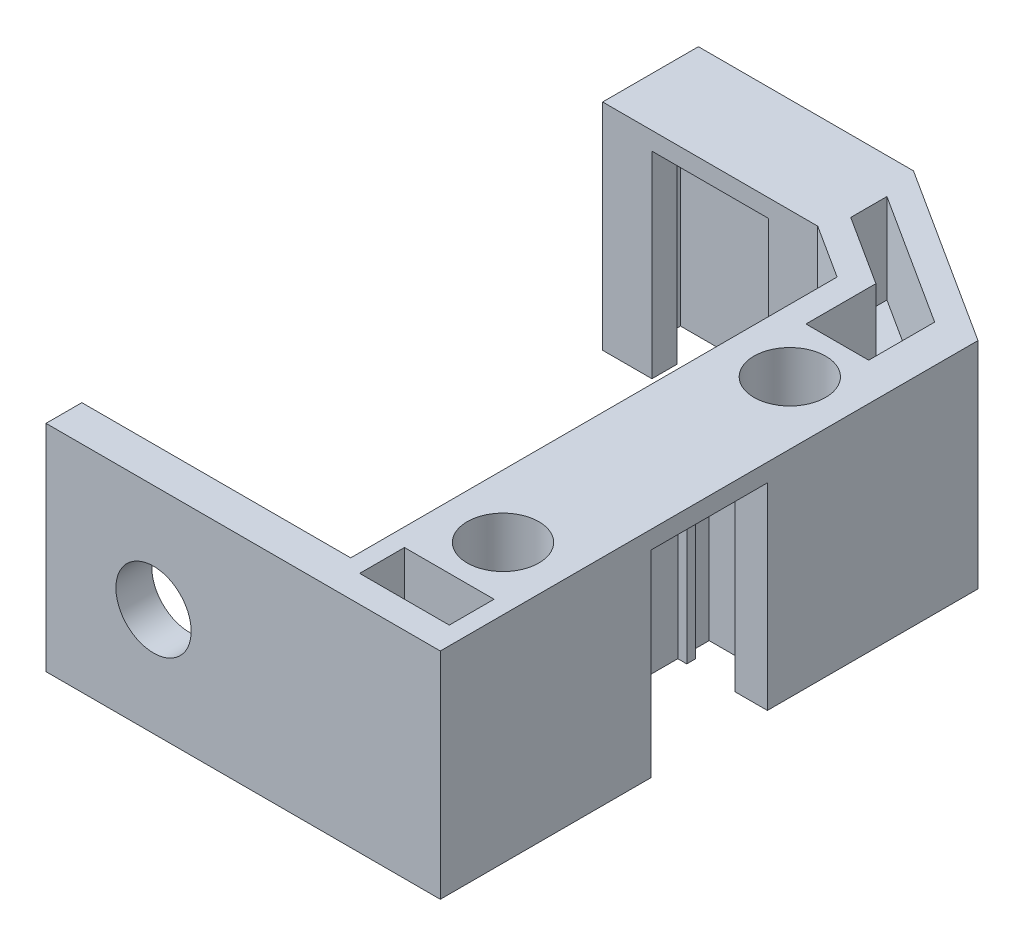
from build123d import *

# Parameters (mm, degrees)
EXTRUDE_1_DEPTH     = 12
SKETCH_2_W          = 5
SKETCH_2_H          = 2.5
CUT_EXTRUDE_1_DEPTH = 5
CUT_EXTRUDE_START   = -12
SKETCH_2_3_W        = 5
SKETCH_2_3_H        = 2.5
CUT_EXTRUDE_3_DEPTH = 5
SKETCH_2_4_R        = 2
CUT_EXTRUDE_4_DEPTH = 45.192307023
CUT_EXTRUDE_5_DEPTH = 11
SKETCH1_R           = 2.1
CUT_EXTRUDE1_DEPTH  = 43.560075188


with BuildPart() as part:
    # 草图1 → 凸台-拉伸1 (new body)
    with BuildSketch(Plane(origin=(0, 0, 0), x_dir=(1, 0, 0), z_dir=(0, 1, 0))):
        Polygon((0, 0), (0, 2), (15, 2), (15, 29.137304051), (12, 31.057304051), (0, 31.057304051), (0, 36.4), (12, 36.4), (22, 30), (22, 0), align=None)
    extrude(amount=EXTRUDE_1_DEPTH)

    # 草图2 → 切除-拉伸1 (cut)
    with BuildSketch(Plane.XZ):
        Polygon((12.5, -32.399476124), (12.5, -34.417827927), (19.9, -29.681827927), (19.9, -26), (16.4, -26), (16.4, -29.903476124), align=None)
        with Locations((18.5, -2.75)):
            Rectangle(SKETCH_2_W, SKETCH_2_H)
    extrude(amount=-CUT_EXTRUDE_1_DEPTH, mode=Mode.SUBTRACT)

    # 草图2<3> → 切除-拉伸3 (cut)
    with BuildSketch(Plane.XZ.offset(CUT_EXTRUDE_START)):
        Polygon((16.4, -26), (16.4, -29.903476124), (12.5, -32.399476124), (12.5, -34.417827927), (19.9, -29.681827927), (19.9, -26), align=None)
        with Locations((18.5, -2.75)):
            Rectangle(SKETCH_2_3_W, SKETCH_2_3_H)
    extrude(amount=CUT_EXTRUDE_3_DEPTH, mode=Mode.SUBTRACT)

    # 草图2<4> → 切除-拉伸4 (cut, through all)
    with BuildSketch(Plane.XZ):
        with Locations(Location((18.5, -23, 0), (0, 0, 270))):
            Circle(SKETCH_2_4_R)
        with Locations(Location((18.5, -7, 0), (0, 0, 270))):
            Circle(SKETCH_2_4_R)
    extrude(amount=-CUT_EXTRUDE_4_DEPTH, mode=Mode.SUBTRACT)

    # 草图2<5> → 切除-拉伸5 (cut)
    with BuildSketch(Plane.XZ):
        Polygon((1, -32.457304051), (1, -34.4), (11, -34.4), (11, -32.457304051), (9.25, -32.457304051), (9.25, -31.057304051), (2.75, -31.057304051), (2.75, -32.457304051), align=None)
        Polygon((17, -18.75), (17, -20), (20.2, -20), (20.2, -18.25), (22, -18.25), (22, -11.75), (20.2, -11.75), (20.2, -10), (17, -10), (17, -11.25), (17.5, -11.25), (17.5, -11.75), (17, -11.75), (17, -18.25), (17.5, -18.25), (17.5, -18.75), align=None)
    extrude(amount=-CUT_EXTRUDE_5_DEPTH, mode=Mode.SUBTRACT)

    # Sketch1 → Cut-Extrude1 (cut, through all)
    with BuildSketch(Plane(origin=(0, 0, -2), x_dir=(-1, 0, 0), z_dir=(0, 0, -1))):
        with Locations((-6, 6)):
            Circle(SKETCH1_R)
    extrude(amount=-CUT_EXTRUDE1_DEPTH, mode=Mode.SUBTRACT)


solid = part.part
